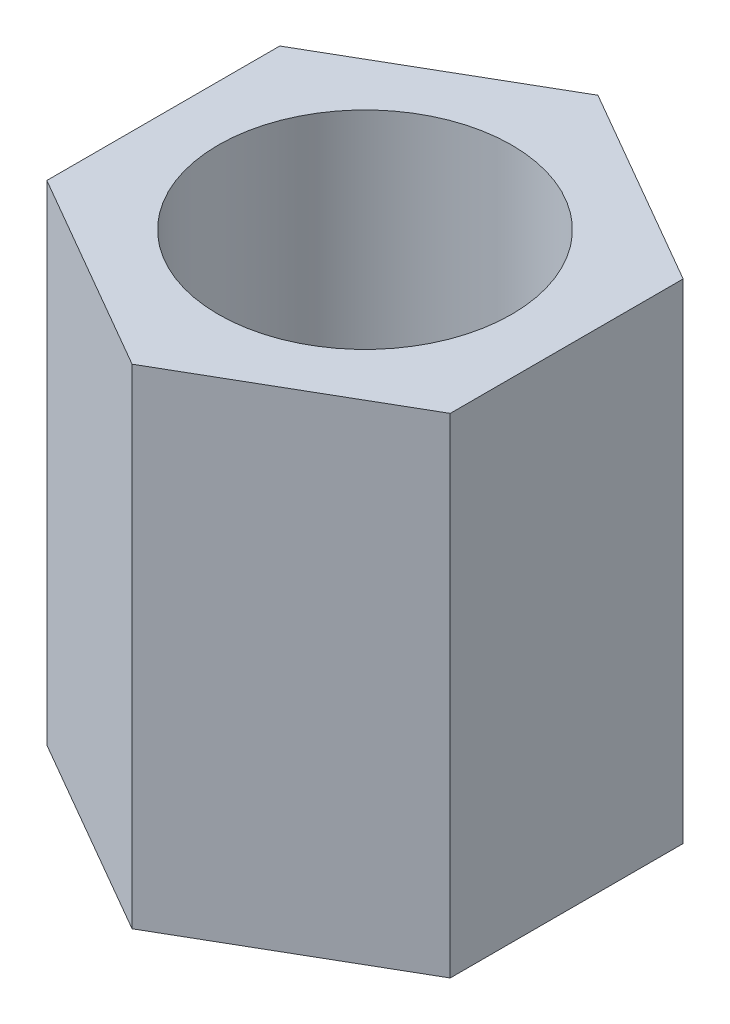
from build123d import *

# Parameters (mm, degrees)
SKETCH_1_R      = 3
EXTRUDE_1_DEPTH = 10


with BuildPart() as part:
    # 草图1 → 凸台-拉伸1 (new body)
    with BuildSketch(Plane(origin=(0, 0, 0), x_dir=(1, 0, 0), z_dir=(0, 1, 0))):
        Polygon((0, 4.763139721), (-4.125, 2.38156986), (-4.125, -2.38156986), (0, -4.763139721), (4.125, -2.38156986), (4.125, 2.38156986), align=None)
        with Locations(Location((0, 0, 0), (0, 0, 270))):
            Circle(SKETCH_1_R, mode=Mode.SUBTRACT)
    extrude(amount=EXTRUDE_1_DEPTH)


solid = part.part
